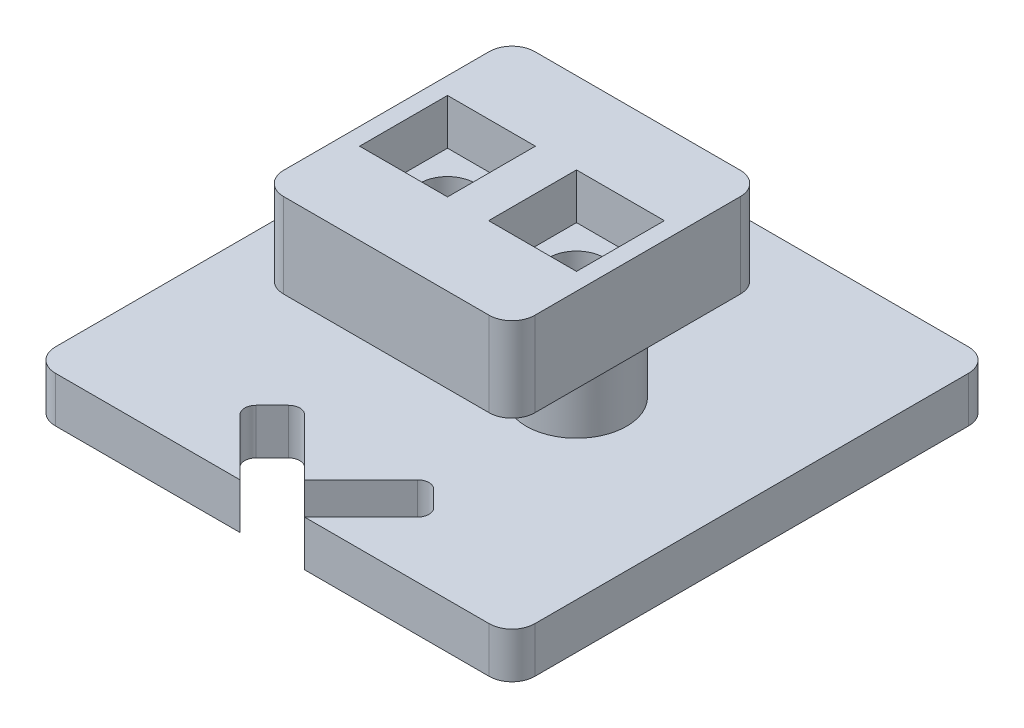
from build123d import *
from build123d.topology import SkipClean

# Parameters (mm, degrees)
SKETCH1_W           = 11
SKETCH1_H           = 11
BOSS_EXTRUDE1_DEPTH = 3.7
FILLET1_R           = 1
SKETCH2_W           = 3.85
SKETCH2_H           = 3.85
CUT_EXTRUDE1_DEPTH  = 2
SKETCH4_R           = 2.2
BOSS_EXTRUDE2_DEPTH = 5
BOSS_EXTRUDE3_DEPTH = 2
SKETCH3_R           = 1.2
CUT_EXTRUDE2_DEPTH  = 18.210171411
CUT_EXTRUDE3_DEPTH  = 17.290794947
SKETCH8_R           = 2.2
SKETCH8_R_2         = 1.2
BOSS_EXTRUDE4_DEPTH = 4


with BuildPart() as part:
    # Sketch1 → Boss-Extrude1 (new body)
    with BuildSketch(Plane(origin=(0, 0, 0), x_dir=(1, 0, 0), z_dir=(0, 1, 0))):
        Rectangle(SKETCH1_W, SKETCH1_H)
    extrude(amount=BOSS_EXTRUDE1_DEPTH)

    # Fillet1
    fillet1_edges = [part.edges().sort_by_distance(p)[0] for p in [
        (5.5, 1.85, 5.5),
        (-5.5, 1.85, 5.5),
        (-5.5, 1.85, -5.5),
        (5.5, 1.85, -5.5),
    ]]
    fillet(fillet1_edges, radius=FILLET1_R)

    # Sketch2 → Cut-Extrude1 (cut)
    with BuildSketch(Plane(origin=(0, 3.7, 0), x_dir=(1, 0, 0), z_dir=(0, 1, 0))):
        with Locations((-2.825, 0)):
            Rectangle(SKETCH2_W, SKETCH2_H)
        with Locations((2.825, 0)):
            Rectangle(SKETCH2_W, SKETCH2_H)
    extrude(amount=-CUT_EXTRUDE1_DEPTH, mode=Mode.SUBTRACT)

    # Sketch4 → Boss-Extrude2 (add)
    with BuildSketch(Plane(origin=(0, 0, 0), x_dir=(-1, 0, 0), z_dir=(0, -1, 0))):
        with Locations(Location((2.825, 0, 0), (0, 0, 90))):
            Circle(SKETCH4_R)
        with Locations(Location((-2.825, 0, 0), (0, 0, 90))):
            Circle(SKETCH4_R)
    extrude(amount=BOSS_EXTRUDE2_DEPTH)

    # Sketch5 → Boss-Extrude3 (add)
    with BuildSketch(Plane(origin=(0, -5, 0), x_dir=(-1, 0, 0), z_dir=(0, -1, 0))):
        with BuildLine():
            Line((9.5, 10.5), (-9.5, 10.5))
            ThreePointArc((-9.5, 10.5), (-10.207106781, 10.207106781), (-10.5, 9.5))
            Line((-10.5, 9.5), (-10.5, -9.5))
            ThreePointArc((-10.5, -9.5), (-10.207106781, -10.207106781), (-9.5, -10.5))
            Line((-9.5, -10.5), (9.5, -10.5))
            ThreePointArc((9.5, -10.5), (10.207106781, -10.207106781), (10.5, -9.5))
            Line((10.5, -9.5), (10.5, 9.5))
            ThreePointArc((10.5, 9.5), (10.207106781, 10.207106781), (9.5, 10.5))
        make_face()
    extrude(amount=-BOSS_EXTRUDE3_DEPTH)

    # Sketch3 → Cut-Extrude2 (cut, through all)
    with BuildSketch(Plane(origin=(0, 3.7, 0), x_dir=(1, 0, 0), z_dir=(0, 1, 0))):
        with Locations(Location((-2.825, 0, 0), (0, 0, 270))):
            Circle(SKETCH3_R)
        with Locations(Location((2.825, 0, 0), (0, 0, 270))):
            Circle(SKETCH3_R)
    extrude(amount=-CUT_EXTRUDE2_DEPTH, mode=Mode.SUBTRACT)

    # Sketch7 → Cut-Extrude3 (cut, through all)
    with BuildSketch(Plane(origin=(0, -3, 0), x_dir=(1, 0, 0), z_dir=(0, 1, 0))):
        with BuildLine():
            Line((0, -9.085786438), (1.414213562, -10.5))
            Line((1.414213562, -10.5), (3.889087297, -8.025126266))
            ThreePointArc((3.889087297, -8.025126266), (4.035533906, -7.671572875), (3.889087297, -7.318019485))
            Line((3.889087297, -7.318019485), (3.181980515, -6.610912703))
            ThreePointArc((3.181980515, -6.610912703), (2.828427125, -6.464466094), (2.474873734, -6.610912703))
            Line((2.474873734, -6.610912703), (0, -9.085786438))
        make_face()
        with BuildLine():
            Line((-3.889087297, -8.025126266), (-1.414213562, -10.5))
            Line((-1.414213562, -10.5), (0, -9.085786438))
            Line((0, -9.085786438), (-2.474873734, -6.610912703))
            ThreePointArc((-2.474873734, -6.610912703), (-2.828427125, -6.464466094), (-3.181980515, -6.610912703))
            Line((-3.181980515, -6.610912703), (-3.889087297, -7.318019485))
            ThreePointArc((-3.889087297, -7.318019485), (-4.035533906, -7.671572875), (-3.889087297, -8.025126266))
        make_face()
        Polygon((-1.414213562, -10.5), (1.414213562, -10.5), (0, -9.085786438), align=None)
    extrude(amount=-CUT_EXTRUDE3_DEPTH, mode=Mode.SUBTRACT)

    # Sketch8 → Boss-Extrude4 (add)
    # profile 1 of 2: a face of its own
    with SkipClean():  # the faces are left unmerged after this step: merging them gives an invalid solid
        with BuildSketch(Plane.XZ.offset(5)):
            with Locations(Location((-2.825, 0, 0), (0, 0, 90))):
                Circle(SKETCH8_R)
            with Locations(Location((-2.825, 0, 0), (0, 0, 270))):
                Circle(SKETCH8_R_2, mode=Mode.SUBTRACT)
        # profile 2 of 2: a face of its own
        with BuildSketch(Plane.XZ.offset(5)):
            with Locations(Location((2.825, 0, 0), (0, 0, 90))):
                Circle(SKETCH8_R)
            with Locations(Location((2.825, 0, 0), (0, 0, 270))):
                Circle(SKETCH8_R_2, mode=Mode.SUBTRACT)
        extrude(amount=BOSS_EXTRUDE4_DEPTH)


solid = part.part
